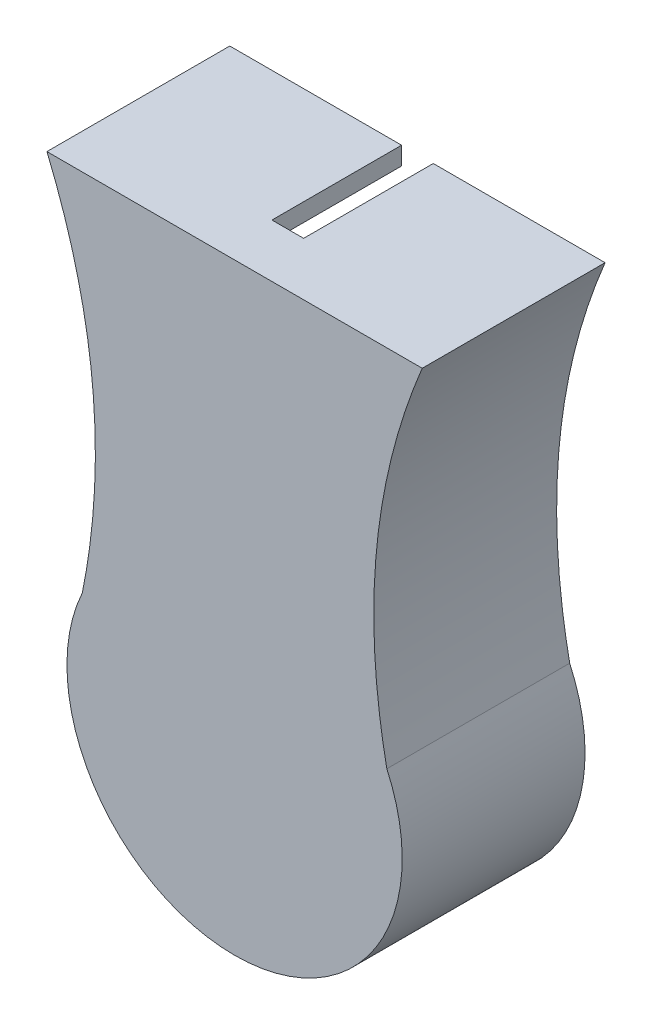
from build123d import *

# Parameters (mm, degrees)
BOSS_EXTRUDE1_DEPTH = 30
SKETCH2_W           = 42.5
SKETCH2_H           = 42.5
SKETCH2_W_2         = 5.2
SKETCH2_H_2         = 2.957646667
CUT_EXTRUDE1_DEPTH  = 21.27


with BuildPart() as part:
    # Sketch1 → Boss-Extrude1 (new body)
    with BuildSketch(Plane.XY):
        with BuildLine():
            Line((30.787284994, 71.307646667), (-30.787284994, 71.307646667))
            add(Edge.make_bspline(
                [(-30.787284994, 71.307646667), (-18.71151784, 42.368167262), (-24.982996832, 11.493470723)],
                knots=[0, 0, 0, 1, 1, 1], degree=2))
            ThreePointArc((-24.982996832, 11.493470723), (0, -27.5), (24.982996832, 11.493470723))
            add(Edge.make_bspline(
                [(30.787284994, 71.307646667), (18.71151784, 42.368167262), (24.982996832, 11.493470723)],
                knots=[0, 0, 0, 1, 1, 1], degree=2))
        make_face()
    extrude(amount=BOSS_EXTRUDE1_DEPTH)

    # Sketch2 → Cut-Extrude1 (cut)
    with BuildSketch(Plane.XY):
        with Locations((0, 45)):
            Rectangle(SKETCH2_W, SKETCH2_H)
        Polygon((-11.6, 66.25), (11.6, 66.25), (11.6, 68.35), (2.6, 68.35), (-2.6, 68.35), (-11.6, 68.35), align=None)
        with Locations((0, 69.828823333)):
            Rectangle(SKETCH2_W_2, SKETCH2_H_2)
    extrude(amount=CUT_EXTRUDE1_DEPTH, mode=Mode.SUBTRACT)


solid = part.part
